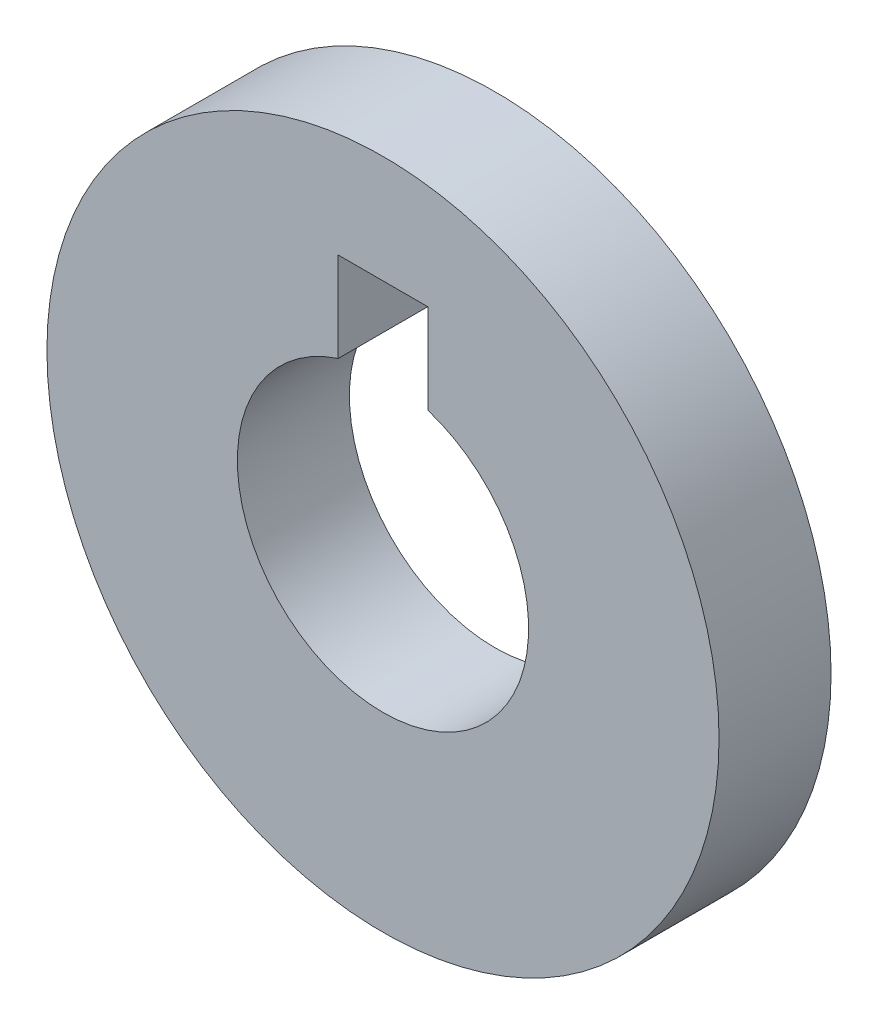
from build123d import *

# Parameters (mm, degrees)
IZIM1_R                     = 15
IZIM1_R_2                   = 6.5
Y_KSEKLIK_EKSTR_ZYON1_DEPTH = 5
IZIM2_W                     = 4
IZIM2_H                     = 4
KES_EKSTR_ZYON1_DEPTH       = 8


with BuildPart() as part:
    # Çizim1 → Yükseklik-Ekstrüzyon1 (new body)
    with BuildSketch(Plane.XY):
        Circle(IZIM1_R)
        Circle(IZIM1_R_2, mode=Mode.SUBTRACT)
    extrude(amount=Y_KSEKLIK_EKSTR_ZYON1_DEPTH)

    # Çizim2 → Kes-Ekstrüzyon1 (cut)
    with BuildSketch(Plane(origin=(0, 0, 0), x_dir=(-1, 0, 0), z_dir=(0, 0, -1))):
        with Locations((0, 8.184658438)):
            Rectangle(IZIM2_W, IZIM2_H)
    extrude(amount=-KES_EKSTR_ZYON1_DEPTH, mode=Mode.SUBTRACT)


solid = part.part
